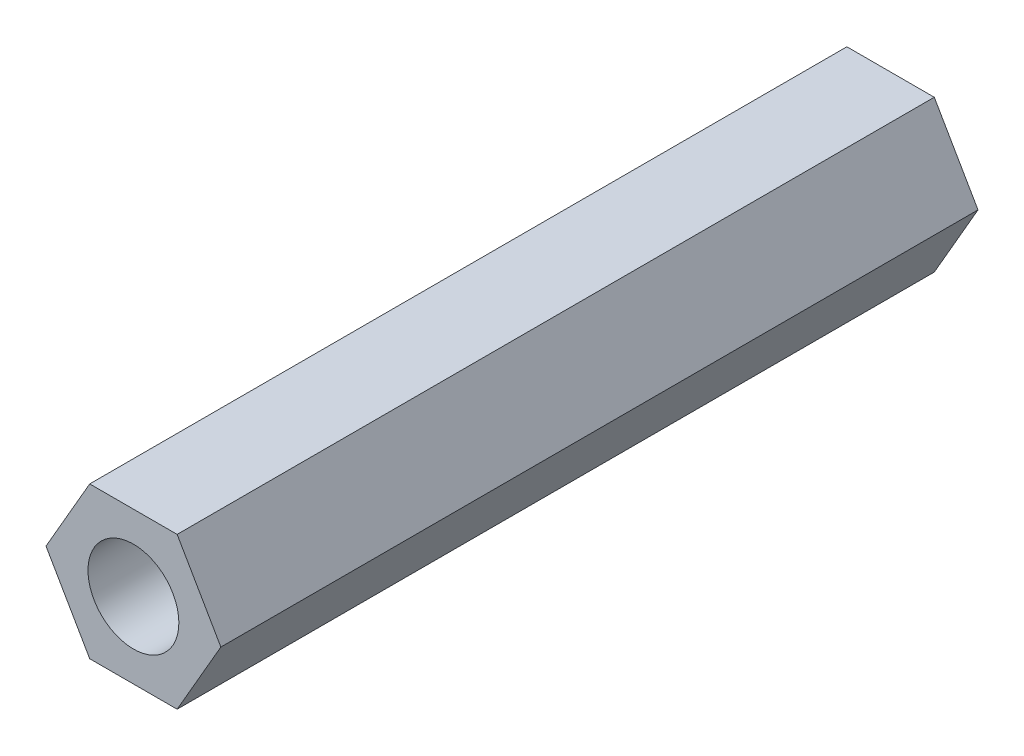
from build123d import *

# Parameters (mm, degrees)
IZIM1_R                     = 1.5
Y_KSEKLIK_EKSTR_ZYON1_DEPTH = 25


with BuildPart() as part:
    # Çizim1 → Yükseklik-Ekstrüzyon1 (new body)
    with BuildSketch(Plane.XY):
        Polygon((1.443375673, -2.5), (2.886751346, 0), (1.443375673, 2.5), (-1.443375673, 2.5), (-2.886751346, 0), (-1.443375673, -2.5), align=None)
        Circle(IZIM1_R, mode=Mode.SUBTRACT)
    extrude(amount=Y_KSEKLIK_EKSTR_ZYON1_DEPTH)


solid = part.part
